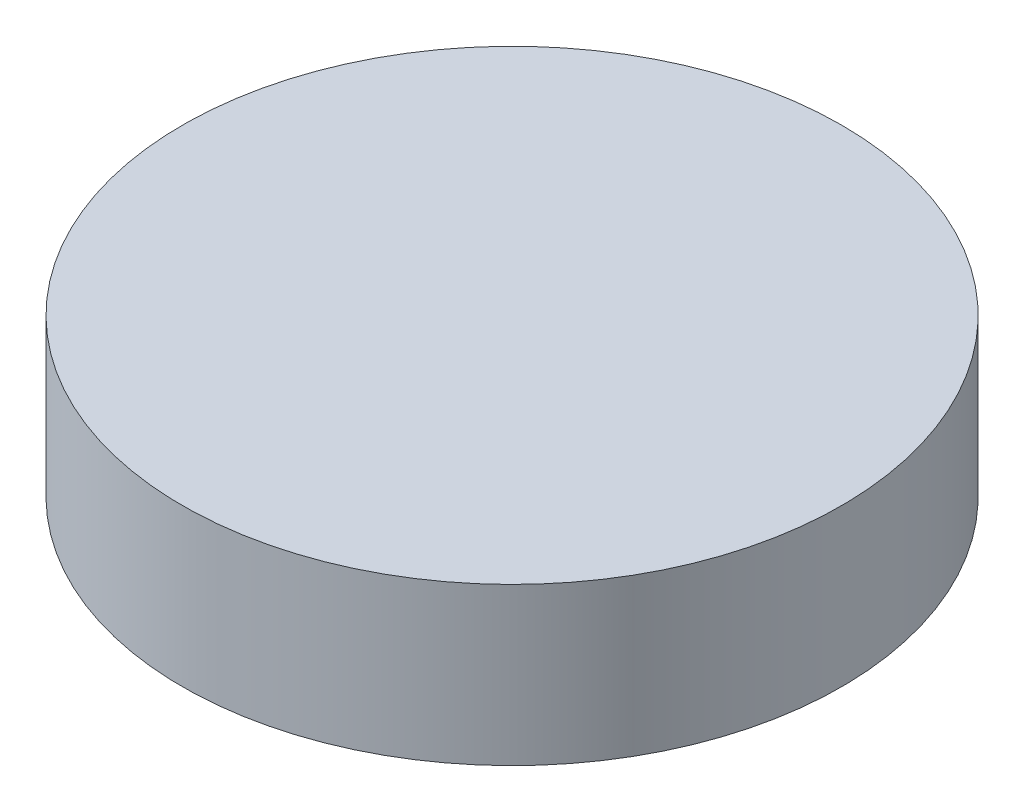
from build123d import *

# Parameters (mm, degrees)
SKETCH_1_W = 10.5
SKETCH_1_H = 5


with BuildPart() as part:
    # 草图1 → Revolve 2 (revolve)
    with BuildSketch(Plane.XY, mode=Mode.PRIVATE) as revolve_2_sk:
        with Locations((5.25, 2.5)):
            Rectangle(SKETCH_1_W, SKETCH_1_H)
    revolve(revolve_2_sk.sketch.rotate(Axis((0, 0, 0), (0, 1, 0)), 90), axis=Axis((0, 0, 0), (0, 1, 0)))


solid = part.part
